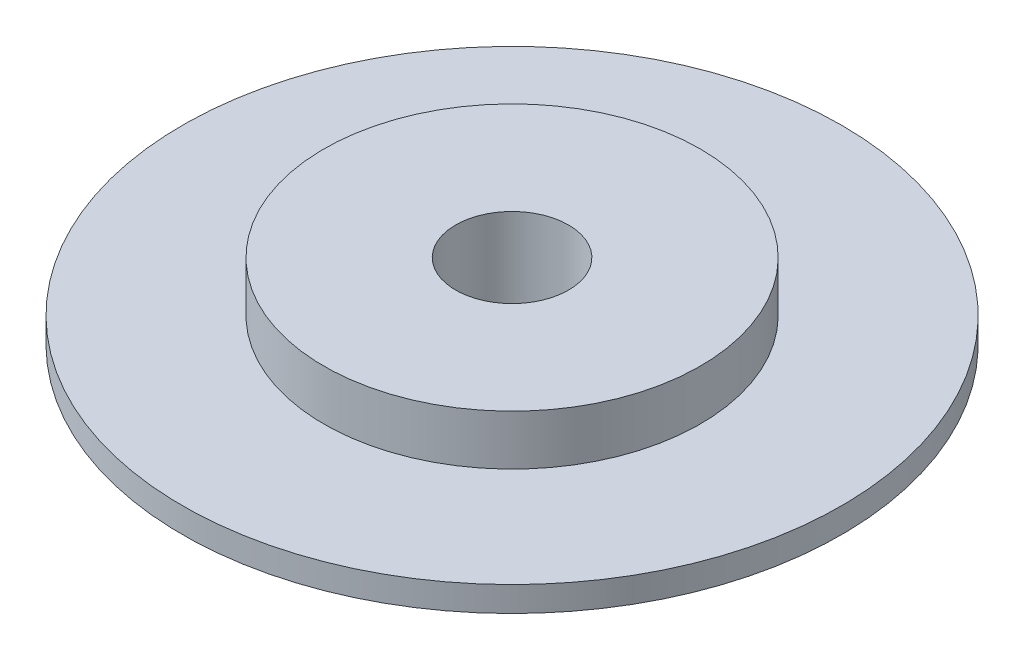
from build123d import *


with BuildPart() as part:
    # Sketch1 → Revolve1 (revolve)
    with BuildSketch(Plane.XY, mode=Mode.PRIVATE) as revolve1_sk:
        Polygon((-2.25, 1.773364486), (-2.25, 6.773364486), (-7.5, 6.773364486), (-7.5, 4.773364486), (-13.135514019, 4.773364486), (-13.135514019, 3.773364486), (-7.5, 3.773364486), (-7.5, 1.773364486), align=None)
    revolve(revolve1_sk.sketch.rotate(Axis((0, 0, 0), (0, 1, 0)), 270), axis=Axis((0, 0, 0), (0, 1, 0)))


solid = part.part
